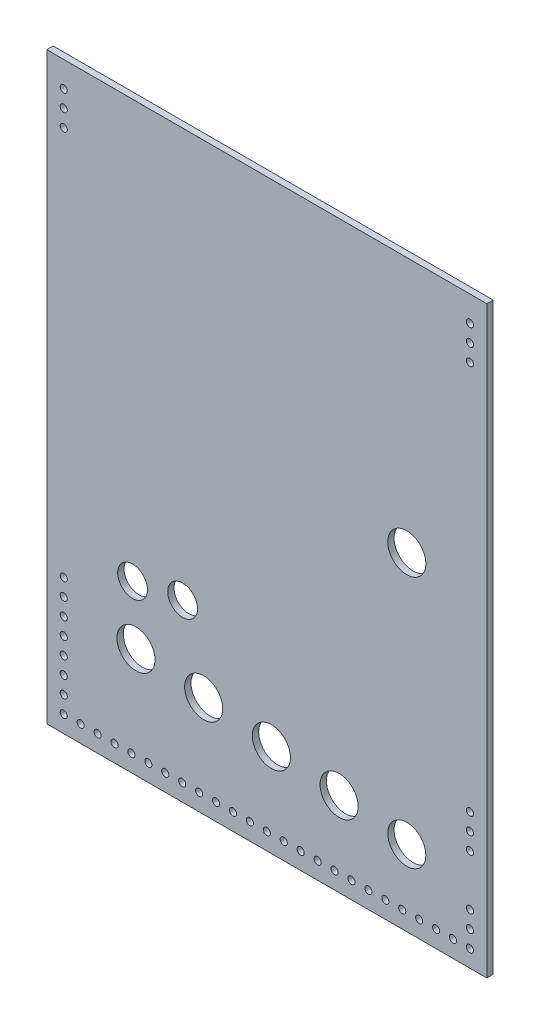
from build123d import *

# Parameters (mm, degrees)
SKETCH1_W           = 330.2
SKETCH1_H           = 438.15
SKETCH1_R           = 14.2875
SKETCH1_R_2         = 11.176
BOSS_EXTRUDE1_DEPTH = 4.7625
SKETCH2_R           = 14.2875
CUT_EXTRUDE1_DEPTH  = 4.7625
SKETCH3_R           = 14.2875
CUT_EXTRUDE2_DEPTH  = 4.7625
SKETCH4_R           = 2.667
CUT_EXTRUDE3_DEPTH  = 549.662140034


with BuildPart() as part:
    # Sketch1 → Boss-Extrude1 (new body)
    with BuildSketch(Plane.XY):
        with Locations((165.1, -219.075)):
            Rectangle(SKETCH1_W, SKETCH1_H)
        with Locations(Location((270.114426387, -191.844382727, 0), (0, 0, 180))):
            Circle(SKETCH1_R, mode=Mode.SUBTRACT)
        with Locations(Location((101.925695163, -306.813385495, 0), (0, 0, 180))):
            Circle(SKETCH1_R_2, mode=Mode.SUBTRACT)
        with Locations(Location((64.374426387, -313.256382727, 0), (0, 0, 180))):
            Circle(SKETCH1_R_2, mode=Mode.SUBTRACT)
    extrude(amount=BOSS_EXTRUDE1_DEPTH)

    # Sketch2 → Cut-Extrude1 (cut)
    with BuildSketch(Plane.XY.offset(4.7625)):
        with Locations((66.914426387, -355.904507537)):
            Circle(SKETCH2_R)
    extrude(amount=-CUT_EXTRUDE1_DEPTH, mode=Mode.SUBTRACT)

    # Sketch3 → Cut-Extrude2 (cut)
    with BuildSketch(Plane.XY.offset(4.7625)):
        with Locations((117.714426387, -362.254507537)):
            Circle(SKETCH3_R)
        with Locations((168.514426387, -368.604507537)):
            Circle(SKETCH3_R)
        with Locations((219.314426387, -374.954507537)):
            Circle(SKETCH3_R)
        with Locations((270.114426387, -381.304507537)):
            Circle(SKETCH3_R)
    extrude(amount=-CUT_EXTRUDE2_DEPTH, mode=Mode.SUBTRACT)

    # Sketch4 → Cut-Extrude3 (cut, through all)
    with BuildSketch(Plane(origin=(0, 0, 0), x_dir=(-1, 0, 0), z_dir=(0, 0, -1))):
        with Locations((-12.7, -425.45)):
            Circle(SKETCH4_R)
        with Locations((-12.7, -412.75)):
            Circle(SKETCH4_R)
        with Locations((-12.7, -400.05)):
            Circle(SKETCH4_R)
        with Locations((-12.7, -387.35)):
            Circle(SKETCH4_R)
        with Locations((-12.7, -374.65)):
            Circle(SKETCH4_R)
        with Locations((-12.7, -361.95)):
            Circle(SKETCH4_R)
        with Locations((-12.7, -349.25)):
            Circle(SKETCH4_R)
        with Locations((-12.7, -336.55)):
            Circle(SKETCH4_R)
        with Locations((-12.7, -44.45)):
            Circle(SKETCH4_R)
        with Locations((-12.7, -31.75)):
            Circle(SKETCH4_R)
        with Locations((-12.7, -19.05)):
            Circle(SKETCH4_R)
        with Locations((-317.5, -361.95)):
            Circle(SKETCH4_R)
        with Locations((-317.5, -349.25)):
            Circle(SKETCH4_R)
        with Locations((-317.5, -336.55)):
            Circle(SKETCH4_R)
        with Locations((-317.5, -400.05)):
            Circle(SKETCH4_R)
        with Locations((-317.5, -412.75)):
            Circle(SKETCH4_R)
        with Locations((-317.5, -425.45)):
            Circle(SKETCH4_R)
        with Locations((-317.5, -44.45)):
            Circle(SKETCH4_R)
        with Locations((-317.5, -31.75)):
            Circle(SKETCH4_R)
        with Locations((-317.5, -19.05)):
            Circle(SKETCH4_R)
        with Locations((-25.4, -425.45)):
            Circle(SKETCH4_R)
        with Locations((-38.1, -425.45)):
            Circle(SKETCH4_R)
        with Locations((-50.8, -425.45)):
            Circle(SKETCH4_R)
        with Locations((-63.5, -425.45)):
            Circle(SKETCH4_R)
        with Locations((-76.2, -425.45)):
            Circle(SKETCH4_R)
        with Locations((-88.9, -425.45)):
            Circle(SKETCH4_R)
        with Locations((-101.6, -425.45)):
            Circle(SKETCH4_R)
        with Locations((-114.3, -425.45)):
            Circle(SKETCH4_R)
        with Locations((-127, -425.45)):
            Circle(SKETCH4_R)
        with Locations((-139.7, -425.45)):
            Circle(SKETCH4_R)
        with Locations((-152.4, -425.45)):
            Circle(SKETCH4_R)
        with Locations((-165.1, -425.45)):
            Circle(SKETCH4_R)
        with Locations((-177.8, -425.45)):
            Circle(SKETCH4_R)
        with Locations((-190.5, -425.45)):
            Circle(SKETCH4_R)
        with Locations((-203.2, -425.45)):
            Circle(SKETCH4_R)
        with Locations((-215.9, -425.45)):
            Circle(SKETCH4_R)
        with Locations((-228.6, -425.45)):
            Circle(SKETCH4_R)
        with Locations((-241.3, -425.45)):
            Circle(SKETCH4_R)
        with Locations((-254, -425.45)):
            Circle(SKETCH4_R)
        with Locations((-266.7, -425.45)):
            Circle(SKETCH4_R)
        with Locations((-279.4, -425.45)):
            Circle(SKETCH4_R)
        with Locations((-292.1, -425.45)):
            Circle(SKETCH4_R)
        with Locations((-304.8, -425.45)):
            Circle(SKETCH4_R)
    extrude(amount=-CUT_EXTRUDE3_DEPTH, mode=Mode.SUBTRACT)


solid = part.part
